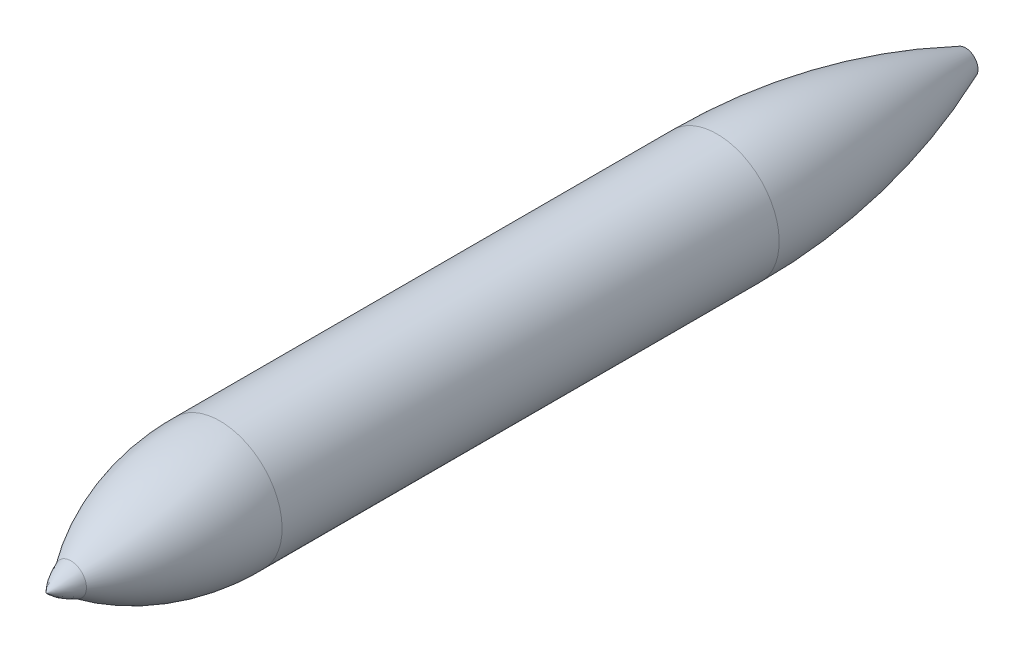
from build123d import *


with BuildPart() as part:
    # Sketch2 → Revolve1 (revolve)
    with BuildSketch(Plane(origin=(0, 0, 0), x_dir=(0, 0, -1), z_dir=(1, 0, 0)), mode=Mode.PRIVATE) as revolve1_sk:
        with BuildLine():
            Line((0, 250), (2000, 250))
            ThreePointArc((2000, 250), (2509.901951359, 199.509756796), (3000, 50))
            Line((3000, 50), (3000, 0))
            Line((3000, 0), (2970, 0))
            Line((2970, 0), (2970, 29.915964903))
            ThreePointArc((2970, 29.915964903), (2494.224630203, 172.031327105), (2000, 220))
            Line((2000, 220), (-0.258692086, 220))
            ThreePointArc((-0.258692086, 220), (-308.259545792, 175.421876817), (-586.291328986, 35.600338834))
            ThreePointArc((-586.291328986, 35.600338834), (-622.203294392, 20.841819856), (-654.961525217, 0))
            Line((-654.961525217, 0), (-700, 0))
            ThreePointArc((-700, 0), (-653.605056812, 37.100018109), (-600, 62.700798984))
            ThreePointArc((-600, 62.700798984), (-315.098484714, 204.717348091), (0, 250))
        make_face()
    revolve(revolve1_sk.sketch.rotate(Axis((0, 0, -2970), (0, 0, -1)), 180), axis=Axis((0, 0, -2970), (0, 0, -1)))


solid = part.part
